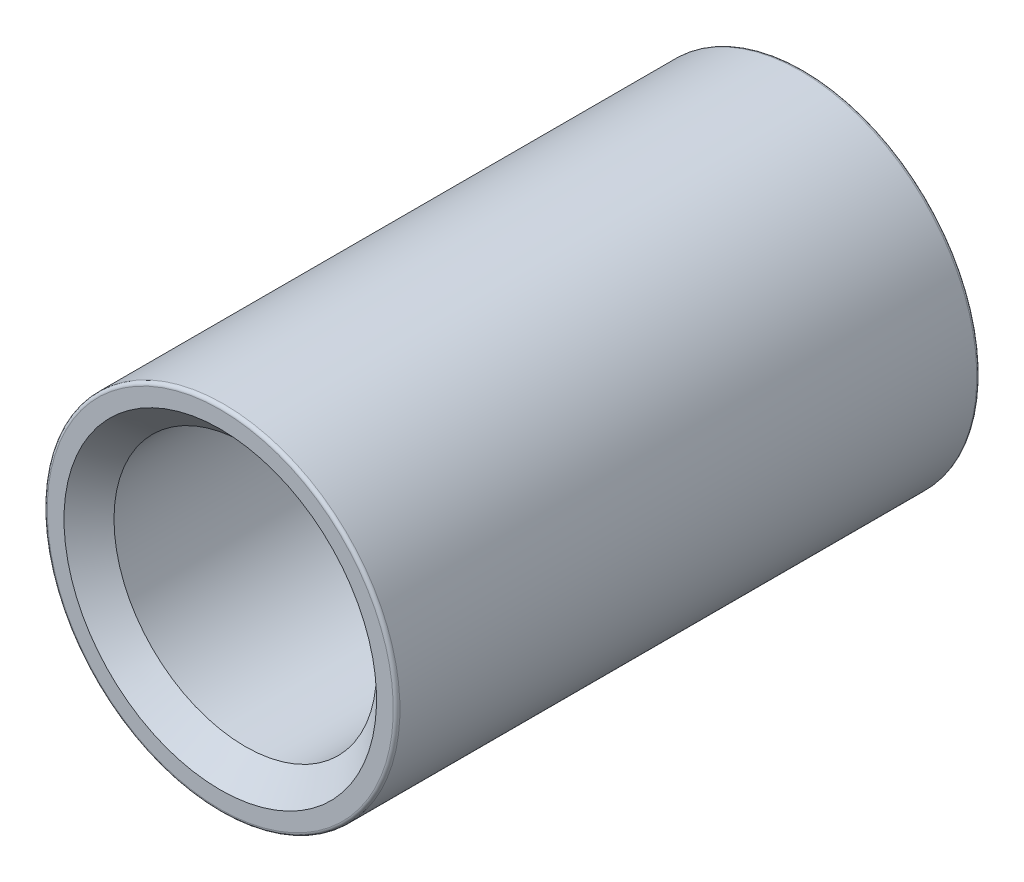
from build123d import *


with BuildPart() as part:
    # Sketch2 → Revolve1 (revolve)
    with BuildSketch(Plane(origin=(0, 0, 0), x_dir=(0, 0, -1), z_dir=(1, 0, 0))):
        with BuildLine():
            Line((-32.295, 9.374), (-32.295, 10.3791))
            ThreePointArc((-32.295, 10.3791), (-32.236421356, 10.520521356), (-32.095, 10.5791))
            Line((-32.095, 10.5791), (2.505, 10.5791))
            ThreePointArc((2.505, 10.5791), (2.646421356, 10.520521356), (2.705, 10.3791))
            Line((2.705, 10.3791), (2.705, 0))
            Line((2.705, 0), (0, 0))
            Line((0, 0), (0, 7.874))
            Line((0, 7.874), (-30.795, 7.874))
            Line((-30.795, 7.874), (-32.295, 9.374))
        make_face()
    revolve(axis=Axis((0, 0, -2.705), (0, 0, 1)))


solid = part.part
